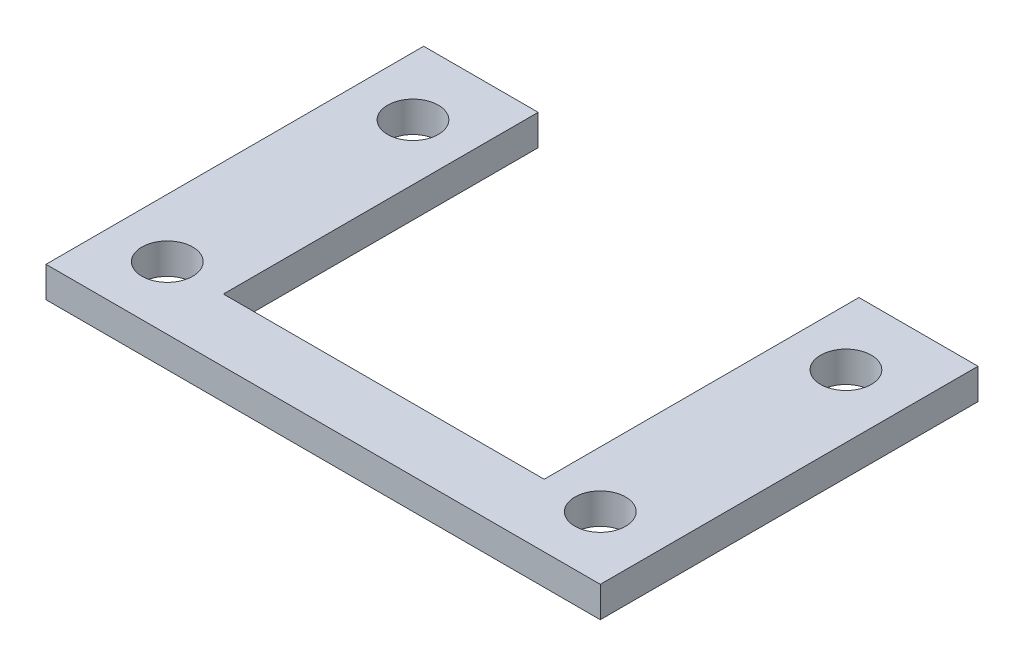
from build123d import *

# Parameters (mm, degrees)
SKETCH1_R           = 2.1
BOSS_EXTRUDE1_DEPTH = 2.54


with BuildPart() as part:
    # Sketch1 → Boss-Extrude1 (new body)
    with BuildSketch(Plane(origin=(0, 0, 0), x_dir=(1, 0, 0), z_dir=(0, 1, 0))):
        Polygon((15.569104138, 29.110597295), (25.03510725, 29.110597295), (25.03510725, 3.075596379), (51.56910725, 3.075596379), (51.56910725, 29.110597295), (61.416111889, 29.110597295), (61.416111889, -2.131403285), (15.569104138, -2.131403285), align=None)
        with Locations(Location((20.39510725, 23.395596379, 0), (0, 0, 270))):
            Circle(SKETCH1_R, mode=Mode.SUBTRACT)
        with Locations(Location((20.39510725, 3.075596379, 0), (0, 0, 270))):
            Circle(SKETCH1_R, mode=Mode.SUBTRACT)
        with Locations(Location((56.20910725, 23.395596379, 0), (0, 0, 270))):
            Circle(SKETCH1_R, mode=Mode.SUBTRACT)
        with Locations(Location((56.20910725, 3.075596379, 0), (0, 0, 270))):
            Circle(SKETCH1_R, mode=Mode.SUBTRACT)
    extrude(amount=BOSS_EXTRUDE1_DEPTH)


solid = part.part
